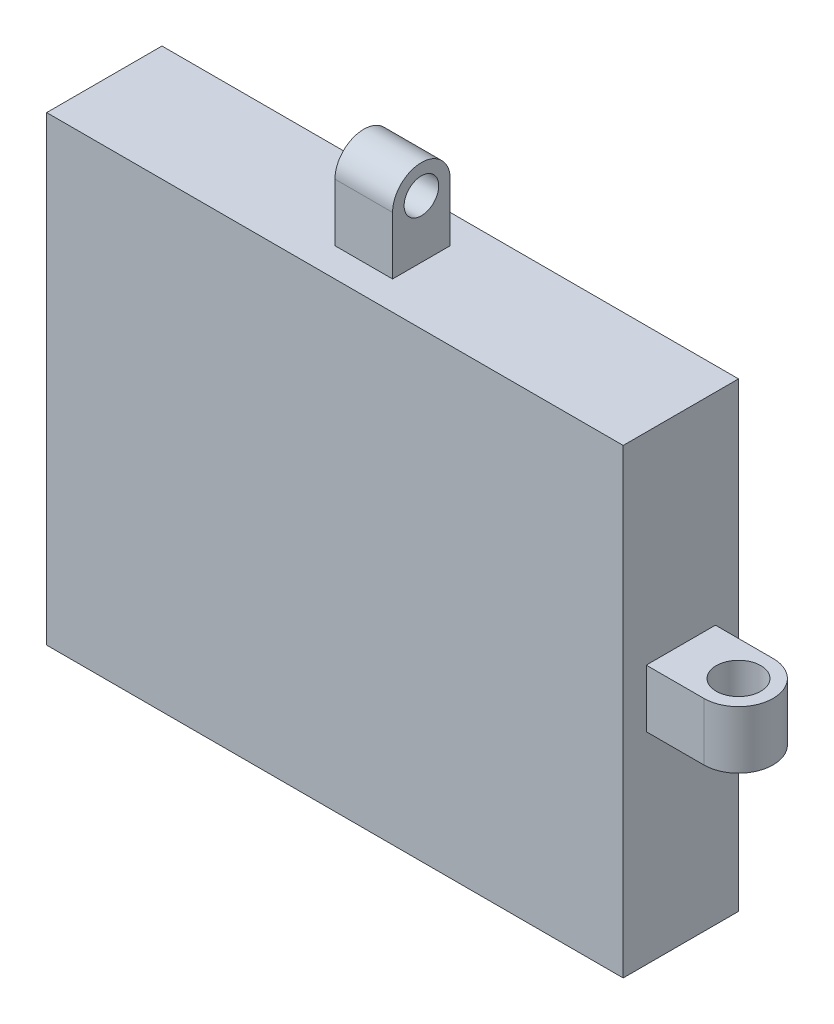
from build123d import *

# Parameters (mm, degrees)
SKETCH1_W           = 50
SKETCH1_H           = 40
BOSS_EXTRUDE1_DEPTH = 10
SKETCH5_W           = 6
SKETCH5_H           = 5
BOSS_EXTRUDE3_DEPTH = 10
SKETCH6_R           = 2
CUT_EXTRUDE1_DEPTH  = 20
SKETCH8_W           = 10
SKETCH8_H           = 40
CUT_EXTRUDE2_DEPTH  = 25
SKETCH9_W           = 10
SKETCH9_H           = 6
SKETCH9_R           = 1.930897171
BOSS_EXTRUDE4_DEPTH = 5
SKETCH10_W          = 10
SKETCH10_H          = 5
CUT_EXTRUDE3_DEPTH  = 15
SKETCH11_W          = 5
SKETCH11_H          = 5
BOSS_EXTRUDE5_DEPTH = 10
SKETCH12_R          = 1.5
CUT_EXTRUDE4_DEPTH  = 10
CUT_EXTRUDE5_DEPTH  = 10
CUT_EXTRUDE6_DEPTH  = 10


with BuildPart() as part:
    # Sketch1 → Boss-Extrude1 (new body)
    with BuildSketch(Plane(origin=(669.84184187, 0, 0), x_dir=(1, 0, 0), z_dir=(0, 0, 1))):
        with Locations((-671.310344828, 437.637931034)):
            Rectangle(SKETCH1_W, SKETCH1_H)
    boss_extrude1 = extrude(amount=BOSS_EXTRUDE1_DEPTH)

    # Sketch5 → Boss-Extrude3 (add)
    with BuildSketch(Plane(origin=(23.531497042, 0, 0), x_dir=(0, 0, -1), z_dir=(1, 0, 0))):
        with Locations((-5, 442.637931034)):
            Rectangle(SKETCH5_W, SKETCH5_H)
        with Locations((-5, 432.637931034)):
            Rectangle(SKETCH5_W, SKETCH5_H)
    extrude(amount=BOSS_EXTRUDE3_DEPTH)

    # Sketch6 → Cut-Extrude1 (cut)
    with BuildSketch(Plane(origin=(669.84184187, 445.137931034, 0), x_dir=(1, 0, 0), z_dir=(0, 1, 0))):
        with Locations(Location((-641.310344828, -5, 0), (0, 0, 180))):
            Circle(SKETCH6_R)
    extrude(amount=-CUT_EXTRUDE1_DEPTH, mode=Mode.SUBTRACT)

    # Sketch8 → Cut-Extrude2 (cut)
    with BuildSketch(Plane.ZY.offset(26.468502958)):
        with Locations((5, 437.637931034)):
            Rectangle(SKETCH8_W, SKETCH8_H)
    extrude(amount=-CUT_EXTRUDE2_DEPTH, mode=Mode.SUBTRACT)

    # Sketch9 → Boss-Extrude4 (add)
    with BuildSketch(Plane(origin=(0, 435.137931034, 0), x_dir=(1, 0, 0), z_dir=(0, 1, 0))):
        with Locations((28.531497042, -5)):
            Rectangle(SKETCH9_W, SKETCH9_H)
        with Locations(Location((28.531497042, -5, 0), (0, 0, 180))):
            Circle(SKETCH9_R, mode=Mode.SUBTRACT)
    extrude(amount=BOSS_EXTRUDE4_DEPTH)

    # Sketch10 → Cut-Extrude3 (cut)
    with BuildSketch(Plane.XY.offset(8)):
        with Locations((28.531497042, 432.637931034)):
            Rectangle(SKETCH10_W, SKETCH10_H)
        with Locations((28.531497042, 442.637931034)):
            Rectangle(SKETCH10_W, SKETCH10_H)
    extrude(amount=-CUT_EXTRUDE3_DEPTH, mode=Mode.SUBTRACT)

    # Mirror1: Boss-Extrude1 across plane
    add(boss_extrude1.mirror(Plane(origin=(-1.468502958, 0, 0), x_dir=(0, 0, 1), z_dir=(1, 0, 0))))

    # Sketch11 → Boss-Extrude5 (add)
    with BuildSketch(Plane(origin=(0, 457.637931034, 0), x_dir=(1, 0, 0), z_dir=(0, 1, 0))):
        with Locations((-1.468502958, -5)):
            Rectangle(SKETCH11_W, SKETCH11_H)
    extrude(amount=BOSS_EXTRUDE5_DEPTH)

    # Sketch12 → Cut-Extrude4 (cut)
    with BuildSketch(Plane(origin=(1.031497042, 0, 0), x_dir=(0, 0, -1), z_dir=(1, 0, 0))):
        with Locations((-5, 462.637931034)):
            Circle(SKETCH12_R)
    extrude(amount=-CUT_EXTRUDE4_DEPTH, mode=Mode.SUBTRACT)

    # Sketch13 → Cut-Extrude5 (cut)
    with BuildSketch(Plane(origin=(1.031497042, 0, 0), x_dir=(0, 0, -1), z_dir=(1, 0, 0))):
        with BuildLine():
            Line((-7.5, 467.637931034), (-7.5, 462.637931034))
            ThreePointArc((-7.5, 462.637931034), (-5, 465.137931034), (-2.5, 462.637931034))
            Line((-2.5, 462.637931034), (-2.5, 467.637931034))
            Line((-2.5, 467.637931034), (-7.5, 467.637931034))
        make_face()
    extrude(amount=-CUT_EXTRUDE5_DEPTH, mode=Mode.SUBTRACT)

    # Sketch14 → Cut-Extrude6 (cut)
    with BuildSketch(Plane(origin=(0, 440.137931034, 0), x_dir=(1, 0, 0), z_dir=(0, 1, 0))):
        with BuildLine():
            Line((33.531497042, -2), (28.531497042, -2))
            ThreePointArc((28.531497042, -2), (30.652817386, -2.878679656), (31.531497042, -5))
            ThreePointArc((31.531497042, -5), (30.652817386, -7.121320344), (28.531497042, -8))
            Line((28.531497042, -8), (33.531497042, -8))
            Line((33.531497042, -8), (33.531497042, -2))
        make_face()
    extrude(amount=-CUT_EXTRUDE6_DEPTH, mode=Mode.SUBTRACT)


solid = part.part
